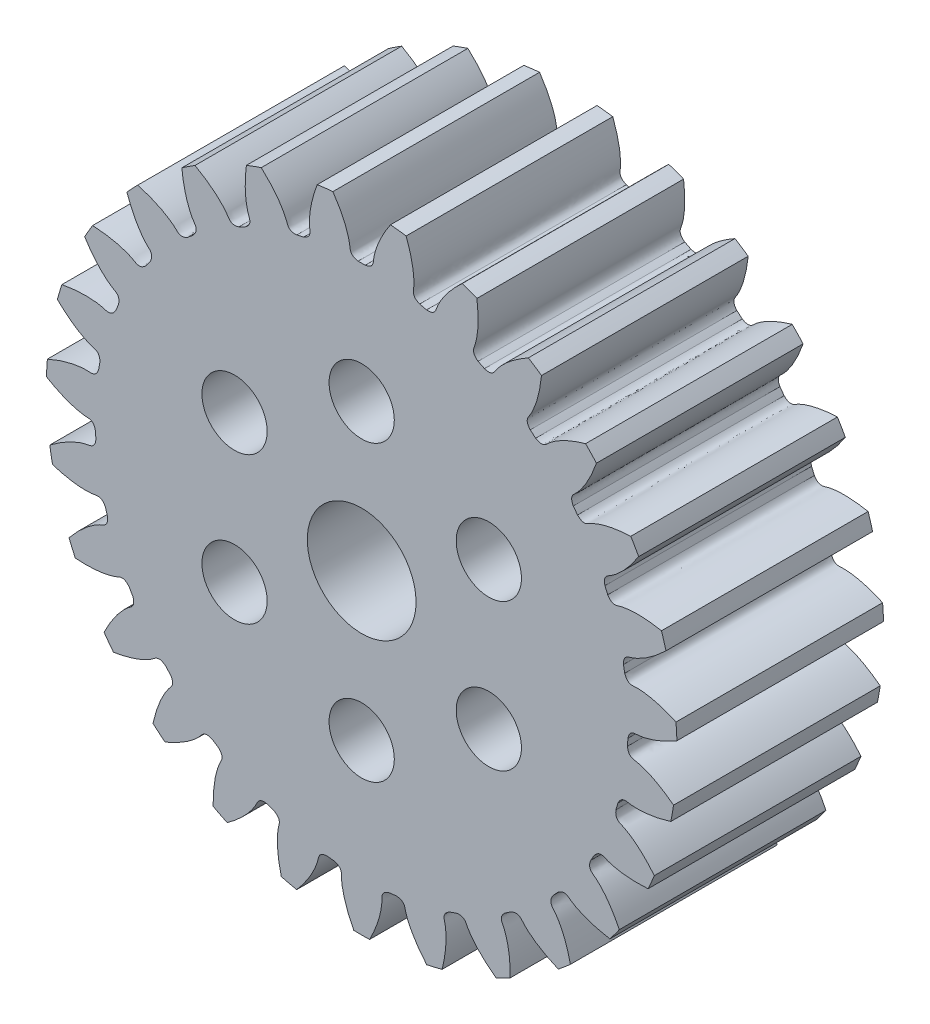
from build123d import *

# Parameters (mm, degrees)
SKETCH_1_R               = 29.000000055
EXTRUDE_1_DEPTH          = 9.5
CUT_EXTRUDE_1_DEPTH      = 43.098099795
PATTERN_CIRCULAR_1_COUNT = 27
SKETCH_8_R               = 17.5
EXTRUDE_2_DEPTH          = 4.5
SKETCH_4_R               = 1.6
CUT_EXTRUDE_2_DEPTH      = 48.258096178
SKETCH_5_R               = 3
CUT_EXTRUDE_3_DEPTH      = 20.5
SKETCH_6_R               = 5
CUT_EXTRUDE_4_DEPTH      = 48.258096178


with BuildPart() as part:
    # 草图1 → 凸台-拉伸1 (new, symmetric)
    with BuildSketch(Plane.XY):
        Circle(SKETCH_1_R)
    extrude(amount=EXTRUDE_1_DEPTH, both=True)

    # 草图2 → 切除-拉伸1 (cut, symmetric)
    with BuildSketch(Plane.XY):
        with BuildLine():
            ThreePointArc((0.323855491, 24.49785945), (0, 24.5), (-0.323855491, 24.49785945))
            add(Edge.make_bspline(
                [(-0.323855491, 24.49785945), (-1.106883853, 24.623960761), (-1.050156715, 25.076848267), (-1.121224516, 25.53249897), (-1.132640173, 25.597473832), (-1.147315687, 25.672164555), (-1.165626286, 25.756466998), (-1.18796702, 25.850260288), (-1.214722074, 25.953413449), (-1.246274293, 26.065783369), (-1.283001748, 26.187215568), (-1.325278403, 26.317544099), (-1.373473506, 26.456591723), (-1.427951384, 26.60417001), (-1.48907111, 26.760079476), (-1.557186217, 26.924109714), (-1.632644405, 27.096039541), (-1.71578725, 27.275637144), (-1.806949921, 27.462660244), (-1.906460894, 27.656856255), (-2.01464168, 27.857962463), (-2.131806548, 28.065706198), (-2.25826226, 28.279805024), (-2.394307802, 28.499966932), (-2.540234129, 28.725890536), (-2.696323906, 28.957265283), (-2.862851265, 29.193771663), (-3.040081554, 29.435081427), (-3.228271101, 29.680857815), (-3.427666981, 29.930755782), (-3.638506789, 30.184422239), (-3.861018416, 30.441496292), (-4.095419833, 30.701609493), (-4.341918881, 30.964386092), (-4.600713072, 31.229443298), (-4.871989381, 31.496391539), (-5.155924079, 31.764834735), (-5.452682458, 32.034370574), (-5.870763087, 32.399112242), (-6.19645628, 32.66628498), (-6.419629616, 32.842186795)],
                knots=[0, 0, 0, 0, 0.119961604, 0.125268853, 0.131541057, 0.138778215, 0.146980327, 0.156147394, 0.166279415, 0.17737639, 0.18943832, 0.202465204, 0.216457043, 0.231413836, 0.247335583, 0.264222285, 0.282073941, 0.300890552, 0.320672116, 0.341418636, 0.363130109, 0.385806537, 0.409447919, 0.434054256, 0.459625547, 0.486161793, 0.513662993, 0.542129147, 0.571560255, 0.601956318, 0.633317336, 0.665643307, 0.698934234, 0.733190114, 0.768410949, 0.804596738, 0.841747482, 0.87986318, 0.918943832, 1, 1, 1, 1], degree=3))
            ThreePointArc((-6.419629616, 32.842186795), (0, 33.463724806), (6.419629616, 32.842186795))
            add(Edge.make_bspline(
                [(0.323855491, 24.49785945), (1.106883853, 24.623960761), (1.050156715, 25.076848267), (1.121224516, 25.53249897), (1.132640173, 25.597473832), (1.147315687, 25.672164555), (1.165626286, 25.756466998), (1.18796702, 25.850260288), (1.214722074, 25.953413449), (1.246274293, 26.065783369), (1.283001748, 26.187215568), (1.325278403, 26.317544099), (1.373473506, 26.456591723), (1.427951384, 26.60417001), (1.48907111, 26.760079476), (1.557186217, 26.924109714), (1.632644405, 27.096039541), (1.71578725, 27.275637144), (1.806949921, 27.462660244), (1.906460894, 27.656856255), (2.01464168, 27.857962463), (2.131806548, 28.065706198), (2.25826226, 28.279805024), (2.394307802, 28.499966932), (2.540234129, 28.725890536), (2.696323906, 28.957265283), (2.862851265, 29.193771663), (3.040081554, 29.435081427), (3.228271101, 29.680857815), (3.427666981, 29.930755782), (3.638506789, 30.184422239), (3.861018416, 30.441496292), (4.095419833, 30.701609493), (4.341918881, 30.964386092), (4.600713072, 31.229443298), (4.871989381, 31.496391539), (5.155924079, 31.764834735), (5.452682458, 32.034370574), (5.870763087, 32.399112242), (6.19645628, 32.66628498), (6.419629616, 32.842186795)],
                knots=[0, 0, 0, 0, 0.119961604, 0.125268853, 0.131541057, 0.138778215, 0.146980327, 0.156147394, 0.166279415, 0.17737639, 0.18943832, 0.202465204, 0.216457043, 0.231413836, 0.247335583, 0.264222285, 0.282073941, 0.300890552, 0.320672116, 0.341418636, 0.363130109, 0.385806537, 0.409447919, 0.434054256, 0.459625547, 0.486161793, 0.513662993, 0.542129147, 0.571560255, 0.601956318, 0.633317336, 0.665643307, 0.698934234, 0.733190114, 0.768410949, 0.804596738, 0.841747482, 0.87986318, 0.918943832, 1, 1, 1, 1], degree=3))
        make_face()
    cut_extrude_1 = extrude(amount=CUT_EXTRUDE_1_DEPTH, both=True, mode=Mode.SUBTRACT)

    # 阵列(圆周)1: 切除-拉伸1 ×27 about axis
    pattern_circular_1_axis = Axis((0, 0, 9.5), (0, 0, -1))
    for i in range(1, PATTERN_CIRCULAR_1_COUNT):
        add(cut_extrude_1.rotate(pattern_circular_1_axis, i * 360 / PATTERN_CIRCULAR_1_COUNT), mode=Mode.SUBTRACT)

    # 草图8 → 凸台-拉伸2 (add)
    with BuildSketch(Plane(origin=(0, 0, -9.5), x_dir=(-1, 0, 0), z_dir=(0, 0, -1))):
        with Locations(Location((0, 0, 0), (0, 0, 180))):
            Circle(SKETCH_8_R)
    extrude(amount=EXTRUDE_2_DEPTH)

    # 草图4 → 切除-拉伸2 (cut, through all)
    with BuildSketch(Plane.XY.offset(9.5)):
        with Locations((0, 13.5)):
            Circle(SKETCH_4_R)
        with Locations((11.691342951, 6.75)):
            Circle(SKETCH_4_R)
        with Locations((11.691342951, -6.75)):
            Circle(SKETCH_4_R)
        with Locations((0, -13.5)):
            Circle(SKETCH_4_R)
        with Locations((-11.691342951, -6.75)):
            Circle(SKETCH_4_R)
        with Locations((-11.691342951, 6.75)):
            Circle(SKETCH_4_R)
    extrude(amount=-CUT_EXTRUDE_2_DEPTH, mode=Mode.SUBTRACT)

    # 草图5 → 切除-拉伸3 (cut)
    with BuildSketch(Plane.XY.offset(9.5)):
        with Locations((0, 13.5)):
            Circle(SKETCH_5_R)
        with Locations((11.691342951, 6.75)):
            Circle(SKETCH_5_R)
        with Locations((11.691342951, -6.75)):
            Circle(SKETCH_5_R)
        with Locations((0, -13.5)):
            Circle(SKETCH_5_R)
        with Locations((-11.691342951, -6.75)):
            Circle(SKETCH_5_R)
        with Locations((-11.691342951, 6.75)):
            Circle(SKETCH_5_R)
    extrude(amount=-CUT_EXTRUDE_3_DEPTH, mode=Mode.SUBTRACT)

    # 草图6 → 切除-拉伸4 (cut, through all)
    with BuildSketch(Plane.XY.offset(9.5)):
        Circle(SKETCH_6_R)
    extrude(amount=-CUT_EXTRUDE_4_DEPTH, mode=Mode.SUBTRACT)


solid = part.part
